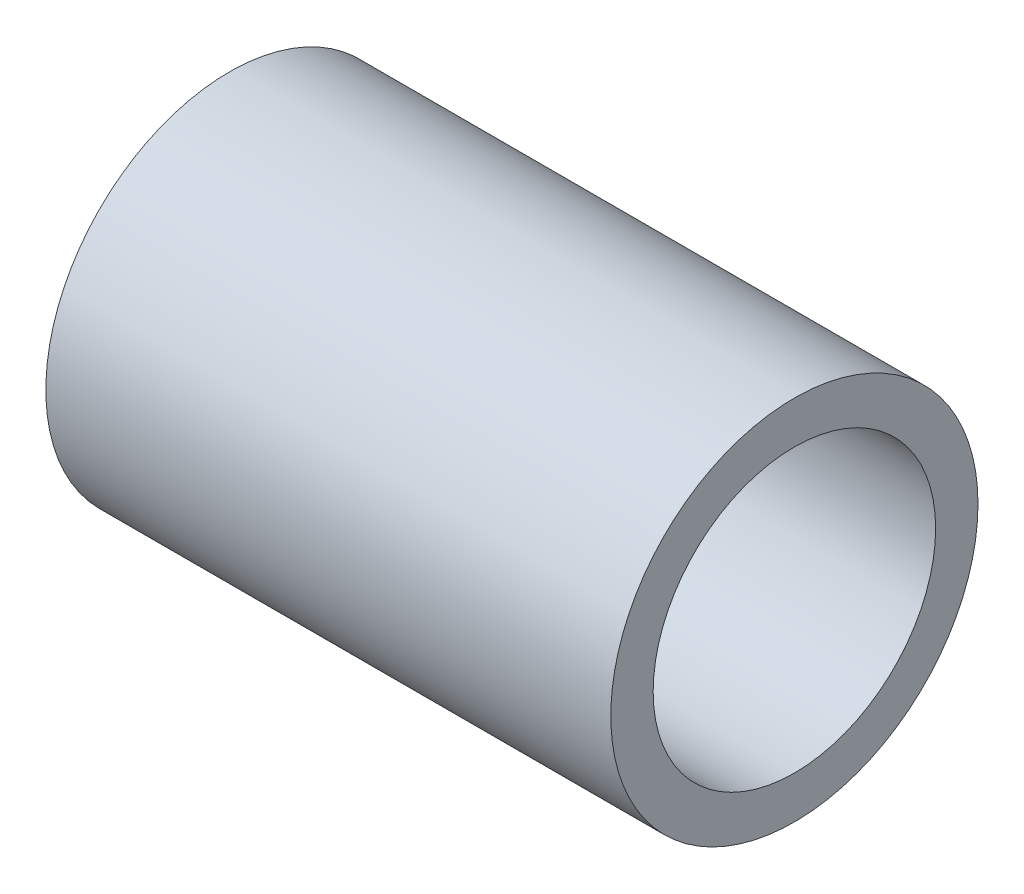
from build123d import *

# Parameters (mm, degrees)
SKETCH1_R           = 6.5
SKETCH1_R_2         = 5
BOSS_EXTRUDE1_DEPTH = 20


with BuildPart() as part:
    # Sketch1 → Boss-Extrude1 (new body)
    with BuildSketch(Plane(origin=(0, 0, 0), x_dir=(0, 0, -1), z_dir=(1, 0, 0))):
        Circle(SKETCH1_R)
        Circle(SKETCH1_R_2, mode=Mode.SUBTRACT)
    extrude(amount=BOSS_EXTRUDE1_DEPTH)


solid = part.part
